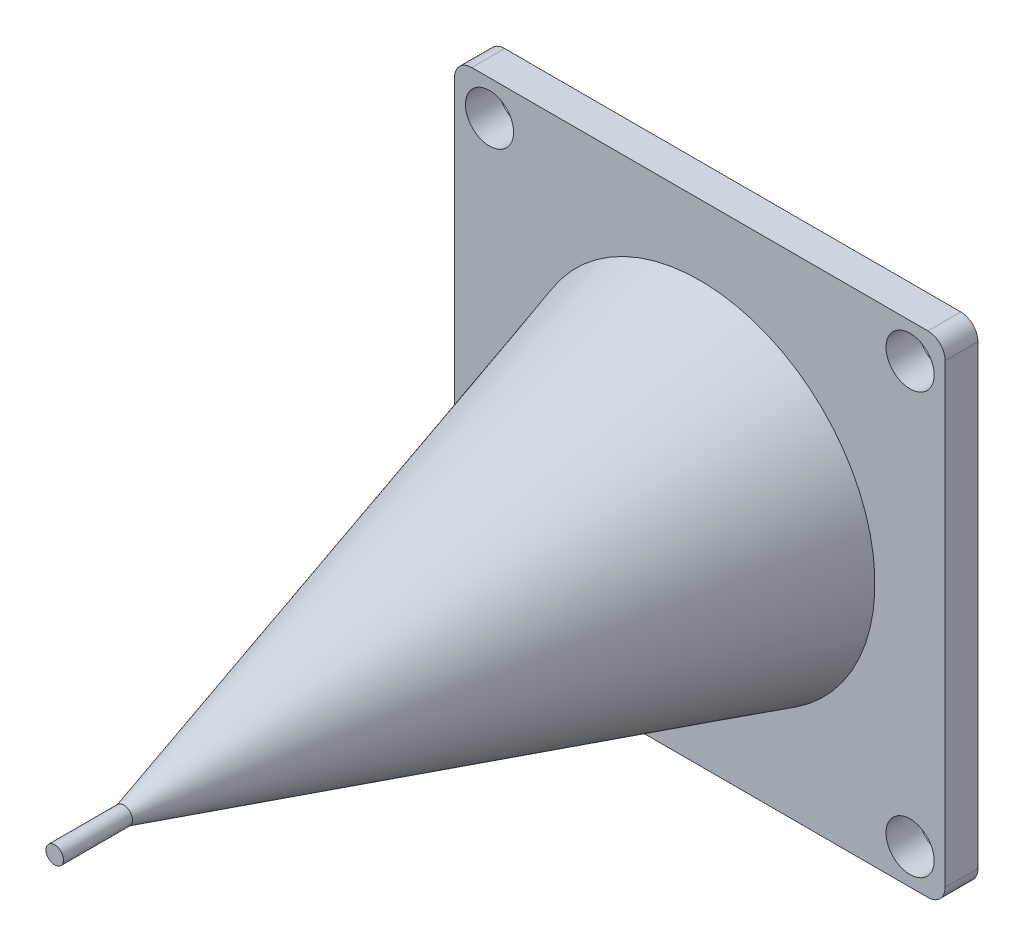
from build123d import *

# Parameters (mm, degrees)
SKETCH1_W           = 71.12
SKETCH1_H           = 71.12
BOSS_EXTRUDE1_DEPTH = 4.7625
SKETCH2_R           = 3.4925
CUT_EXTRUDE1_DEPTH  = 51.514439582
SKETCH3_R           = 25.382
BOSS_EXTRUDE2_DEPTH = 83.5
SKETCH5_R           = 1.27
BOSS_EXTRUDE3_DEPTH = 10
FILLET1_R           = 2.5


with BuildPart() as part:
    # Sketch1 → Boss-Extrude1 (new body)
    with BuildSketch(Plane.XY):
        Rectangle(SKETCH1_W, SKETCH1_H)
    extrude(amount=BOSS_EXTRUDE1_DEPTH)

    # Sketch2 → Cut-Extrude1 (cut, through all)
    with BuildSketch(Plane.XY.offset(4.7625)):
        with Locations((-30.48, 30.48)):
            Circle(SKETCH2_R)
        with Locations((30.48, 30.48)):
            Circle(SKETCH2_R)
    cut_extrude1 = extrude(amount=-CUT_EXTRUDE1_DEPTH, mode=Mode.SUBTRACT)

    # Mirror1: Cut-Extrude1 across plane
    add(cut_extrude1.mirror(Plane.ZX), mode=Mode.SUBTRACT)

    # Sketch3 → Boss-Extrude2 (add)
    with BuildSketch(Plane.XY.offset(4.7625)):
        with Locations(Location((0, 0, 0), (0, 0, 180))):
            Circle(SKETCH3_R)
    extrude(amount=BOSS_EXTRUDE2_DEPTH)

    # Sketch4 → Cut-Revolve1 (revolve, cut)
    with BuildSketch(Plane(origin=(0, 0, 0), x_dir=(0, 0, -1), z_dir=(1, 0, 0)), mode=Mode.PRIVATE) as cut_revolve1_sk:
        Polygon((-4.7625, 25.382), (-88.2625, 1.245), (-88.2625, 25.382), align=None)
    revolve(cut_revolve1_sk.sketch.rotate(Axis((0, 0, 88.2625), (0, 0, -1)), 270), axis=Axis((0, 0, 88.2625), (0, 0, -1)), mode=Mode.SUBTRACT)

    # Sketch5 → Boss-Extrude3 (add)
    with BuildSketch(Plane.XY.offset(88.2625)):
        Circle(SKETCH5_R)
    extrude(amount=BOSS_EXTRUDE3_DEPTH)

    # Fillet1
    fillet1_edges = [part.edges().sort_by_distance(p)[0] for p in [
        (-35.56, 35.56, 2.38125),
        (35.56, 35.56, 2.38125),
        (35.56, -35.56, 2.38125),
        (-35.56, -35.56, 2.38125),
    ]]
    fillet(fillet1_edges, radius=FILLET1_R)


solid = part.part
